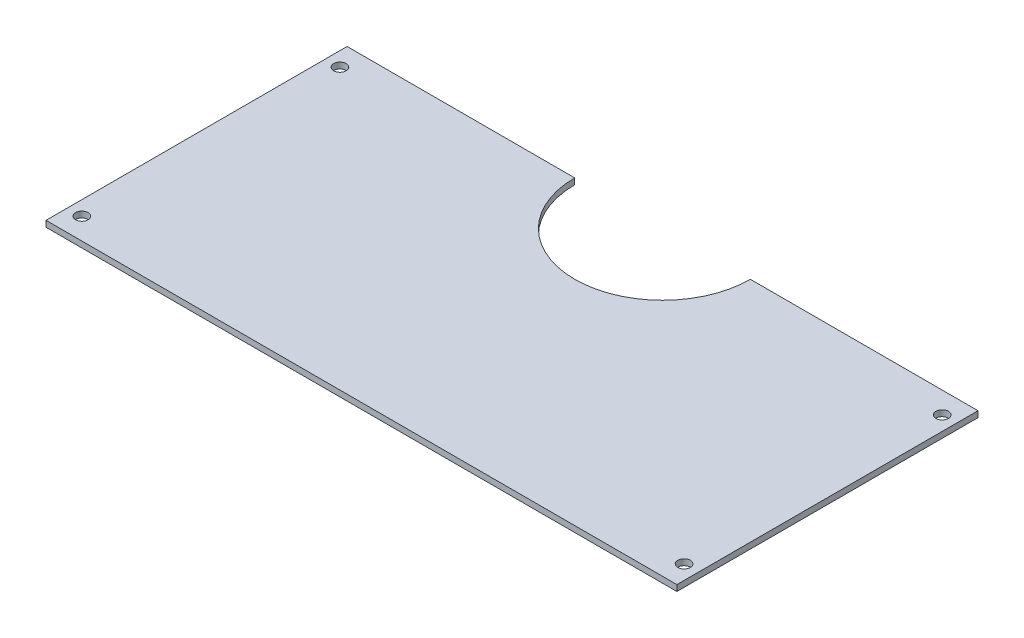
from build123d import *

# Parameters (mm, degrees)
SKETCH1_W           = 279.4
SKETCH1_H           = 133.35
BOSS_EXTRUDE1_DEPTH = 1.3335
CUT_EXTRUDE2_START  = 1.3335
SKETCH2_R           = 38.8874
CUT_EXTRUDE2_DEPTH  = 157.134739812
CUT_EXTRUDE4_START  = 1.3335
SKETCH3_R           = 2.7686
CUT_EXTRUDE4_DEPTH  = 157.134739812


with BuildPart() as part:
    # Sketch1 → Boss-Extrude1 (new, symmetric)
    with BuildSketch(Plane(origin=(0, 0, 0), x_dir=(1, 0, 0), z_dir=(0, 1, 0))):
        Rectangle(SKETCH1_W, SKETCH1_H)
    extrude(amount=BOSS_EXTRUDE1_DEPTH, both=True)

    # Sketch2 → Cut-Extrude2 (cut, through all)
    with BuildSketch(Plane(origin=(0, 0, 0), x_dir=(1, 0, 0), z_dir=(0, 1, 0)).offset(CUT_EXTRUDE2_START)):
        with Locations((0, 66.675)):
            Circle(SKETCH2_R)
    extrude(amount=-CUT_EXTRUDE2_DEPTH, mode=Mode.SUBTRACT)

    # Sketch3 → Cut-Extrude4 (cut, through all)
    with BuildSketch(Plane(origin=(0, 0, 0), x_dir=(1, 0, 0), z_dir=(0, 1, 0)).offset(CUT_EXTRUDE4_START)):
        with Locations(Location((-133.35, -57.15, 0), (0, 0, 270))):
            Circle(SKETCH3_R)
        with Locations(Location((133.35, -57.15, 0), (0, 0, 270))):
            Circle(SKETCH3_R)
        with Locations(Location((-133.35, 57.15, 0), (0, 0, 270))):
            Circle(SKETCH3_R)
        with Locations(Location((133.35, 57.15, 0), (0, 0, 270))):
            Circle(SKETCH3_R)
    extrude(amount=-CUT_EXTRUDE4_DEPTH, mode=Mode.SUBTRACT)


solid = part.part
